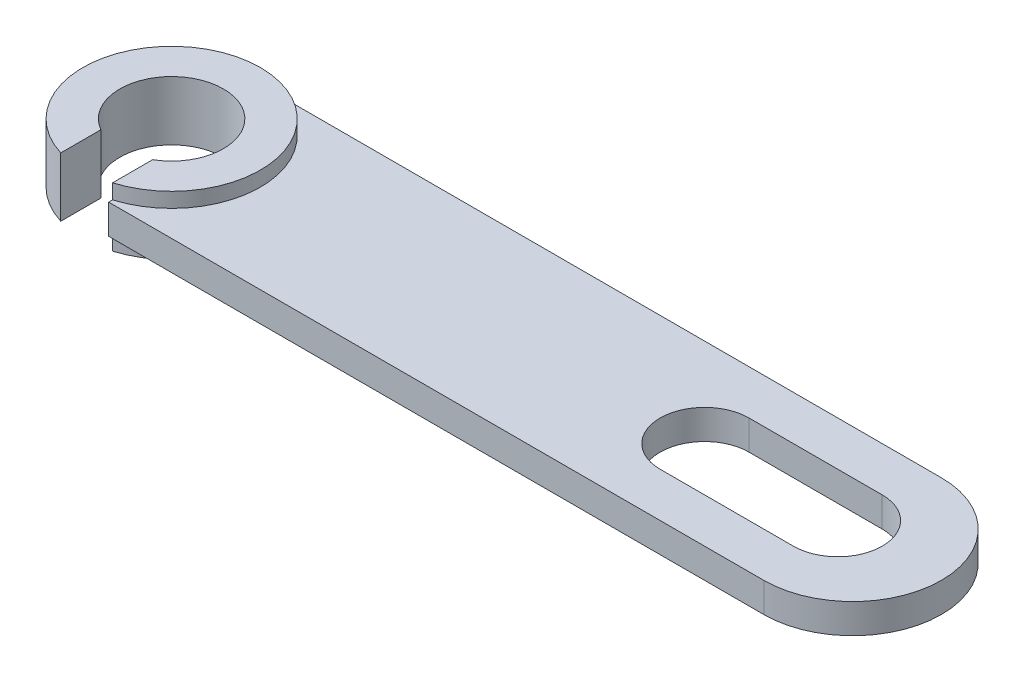
from build123d import *

# Parameters (mm, degrees)
SCHIZZO1_R                    = 1.75
ESTRUSIONE_ESTRUSIONE1_DEPTH  = 0.5
TAGLIO_ESTRUSIONE2_DEPTH      = 15.81553239
TAGLIO_ESTRUSIONE2_DEPTH_BACK = 15.81553239
ESTRUSIONE_ESTRUSIONE2_DEPTH  = 1


with BuildPart() as part:
    # Schizzo1 → Estrusione-Estrusione1 (new, symmetric)
    with BuildSketch(Plane(origin=(0, 0, 0), x_dir=(1, 0, 0), z_dir=(0, 1, 0))):
        with BuildLine():
            Line((-11.5, 3), (11.5, 3))
            ThreePointArc((11.5, 3), (14.5, 0), (11.5, -3))
            Line((11.5, -3), (-11.5, -3))
            ThreePointArc((-11.5, -3), (-14.5, 0), (-11.5, 3))
        make_face()
        with Locations(Location((-11.5, 0, 0), (0, 0, 270))):
            Circle(SCHIZZO1_R, mode=Mode.SUBTRACT)
        with BuildLine():
            Line((11, -1.5), (6.5, -1.5))
            ThreePointArc((6.5, -1.5), (5, 0), (6.5, 1.5))
            Line((6.5, 1.5), (11, 1.5))
            ThreePointArc((11, 1.5), (12.5, 0), (11, -1.5))
        make_face(mode=Mode.SUBTRACT)
    extrude(amount=ESTRUSIONE_ESTRUSIONE1_DEPTH, both=True)

    # Schizzo2 → Taglio-Estrusione2 (cut, two sides: drawn at the far end of the back side and taken through both)
    with BuildSketch(Plane(origin=(0, 0, 0), x_dir=(1, 0, 0), z_dir=(0, 1, 0)).offset(-TAGLIO_ESTRUSIONE2_DEPTH_BACK)):
        with BuildLine():
            Line((-10.625, -1.515544457), (-10.625, -3))
            Line((-10.625, -3), (-11.5, -3))
            ThreePointArc((-11.5, -3), (-11.942334595, -2.967210829), (-12.375, -2.869560071))
            Line((-12.375, -2.869560071), (-12.375, -1.515544457))
            ThreePointArc((-12.375, -1.515544457), (-11.5, -1.75), (-10.625, -1.515544457))
        make_face()
    extrude(amount=TAGLIO_ESTRUSIONE2_DEPTH + TAGLIO_ESTRUSIONE2_DEPTH_BACK, mode=Mode.SUBTRACT)

    # Schizzo4 → Estrusione-Estrusione2 (add, symmetric)
    with BuildSketch(Plane(origin=(0, 0, 0), x_dir=(1, 0, 0), z_dir=(0, 1, 0))):
        with BuildLine():
            Line((-10.625, -2.869560071), (-10.625, -1.515544457))
            ThreePointArc((-10.625, -1.515544457), (-11.5, 1.75), (-12.375, -1.515544457))
            Line((-12.375, -1.515544457), (-12.375, -2.869560071))
            ThreePointArc((-12.375, -2.869560071), (-11.5, 3), (-10.625, -2.869560071))
        make_face()
    extrude(amount=ESTRUSIONE_ESTRUSIONE2_DEPTH, both=True)


solid = part.part
